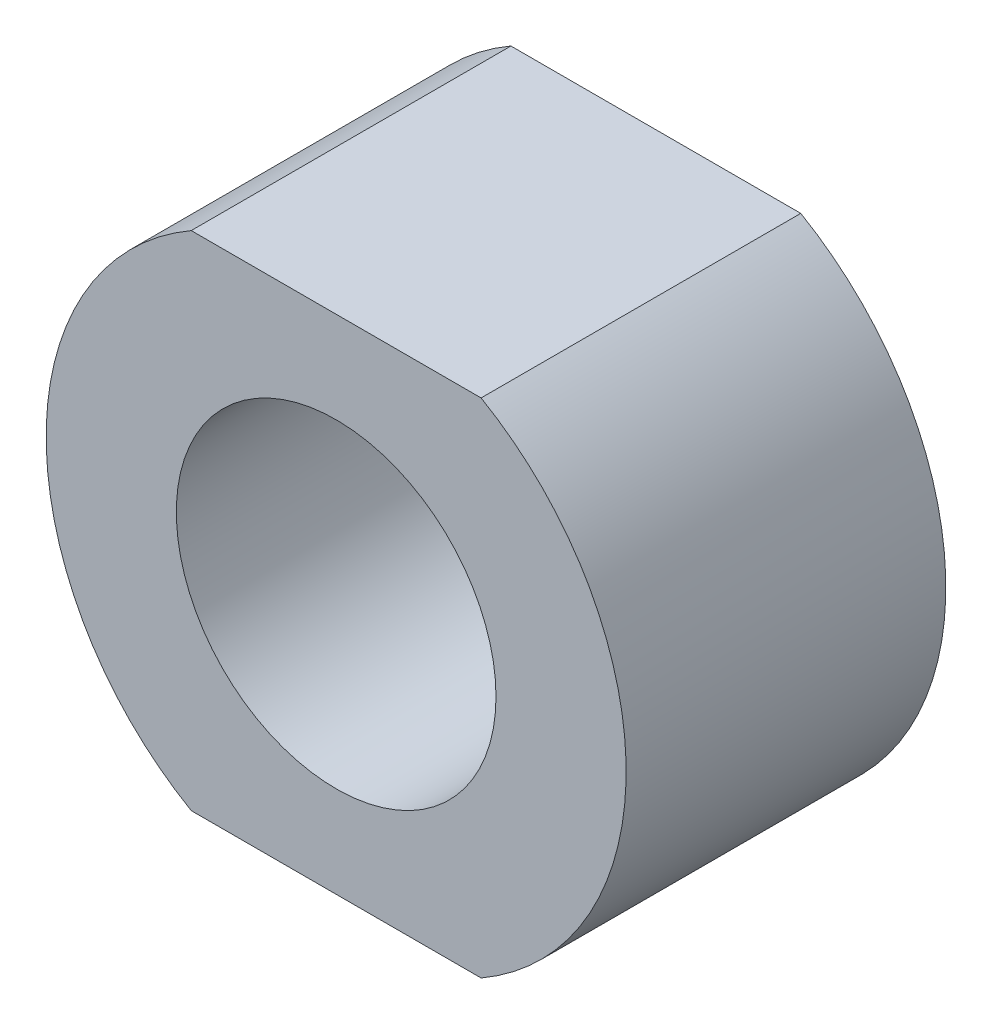
from build123d import *

# Parameters (mm, degrees)
ESQUISSE1_R             = 6.35
BOSS_EXTRU_1_DEPTH      = 7
ESQUISSE2_R             = 3.5
ENL_V_MAT_EXTRU_1_DEPTH = 7
ESQUISSE3_W             = 10.71653065
ESQUISSE3_H             = 1.876238016
ENL_V_MAT_EXTRU_2_DEPTH = 12.386175829


with BuildPart() as part:
    # Esquisse1 → Boss.-Extru.1 (new body)
    with BuildSketch(Plane.XY):
        Circle(ESQUISSE1_R)
    extrude(amount=BOSS_EXTRU_1_DEPTH)

    # Esquisse2 → Enlèv. mat.-Extru.1 (cut)
    with BuildSketch(Plane.XY.offset(7)):
        Circle(ESQUISSE2_R)
    extrude(amount=-ENL_V_MAT_EXTRU_1_DEPTH, mode=Mode.SUBTRACT)

    # Esquisse3 → Enlèv. mat.-Extru.2 (cut, through all)
    with BuildSketch(Plane.XY.offset(7)):
        with Locations((0.338060904, 6.438119008)):
            Rectangle(ESQUISSE3_W, ESQUISSE3_H)
        with Locations((0.338060904, -6.438119008)):
            Rectangle(ESQUISSE3_W, ESQUISSE3_H)
    extrude(amount=-ENL_V_MAT_EXTRU_2_DEPTH, mode=Mode.SUBTRACT)


solid = part.part
